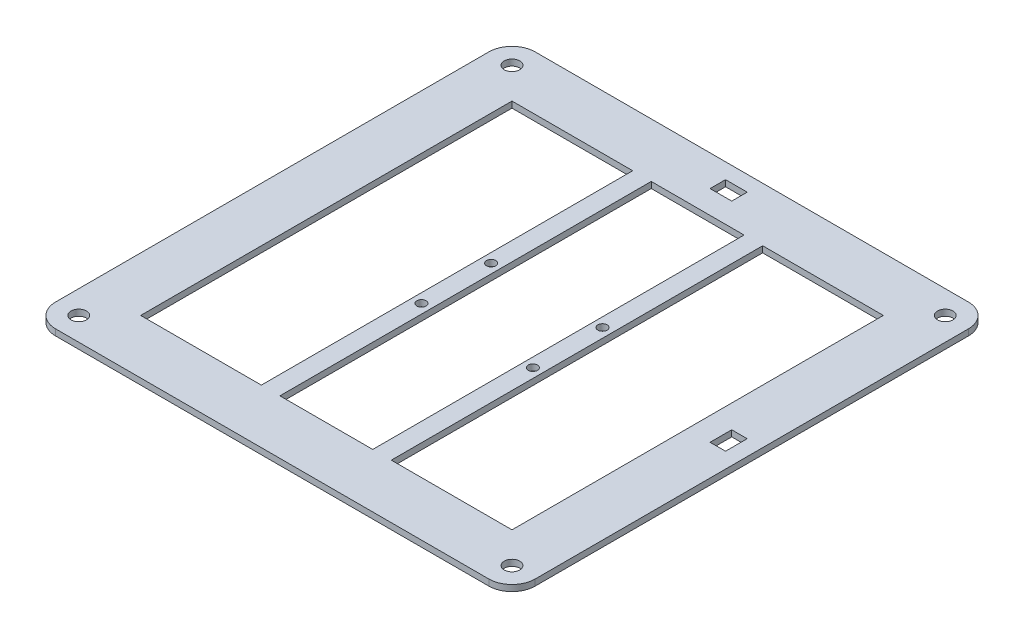
from build123d import *

# Parameters (mm, degrees)
CROQUIS1_W              = 160
CROQUIS1_H              = 160
CROQUIS1_R              = 1.5
CROQUIS1_R_2            = 2.5
CROQUIS1_W_2            = 39
CROQUIS1_H_2            = 120
CROQUIS1_W_3            = 30
CROQUIS1_W_4            = 5
CROQUIS1_H_3            = 7
CROQUIS1_W_5            = 7
CROQUIS1_H_4            = 5
SALIENTE_EXTRUIR1_DEPTH = 2
CORTAR_EXTRUIR1_DEPTH   = 10


with BuildPart() as part:
    # Croquis1 → Saliente-Extruir1 (new body)
    with BuildSketch(Plane(origin=(0, 0, 0), x_dir=(1, 0, 0), z_dir=(0, 1, 0))):
        with Locations((70, 70)):
            Rectangle(CROQUIS1_W, CROQUIS1_H)
        with Locations(Location((52, 81.25, 0), (0, 0, 270))):
            Circle(CROQUIS1_R, mode=Mode.SUBTRACT)
        with Locations(Location((52, 58.75, 0), (0, 0, 270))):
            Circle(CROQUIS1_R, mode=Mode.SUBTRACT)
        with Locations(Location((0, 140, 0), (0, 0, 270))):
            Circle(CROQUIS1_R_2, mode=Mode.SUBTRACT)
        with Locations(Location((0, 0, 0), (0, 0, 270))):
            Circle(CROQUIS1_R_2, mode=Mode.SUBTRACT)
        with Locations(Location((88, 81.25, 0), (0, 0, 90))):
            Circle(CROQUIS1_R, mode=Mode.SUBTRACT)
        with Locations(Location((88, 58.75, 0), (0, 0, 90))):
            Circle(CROQUIS1_R, mode=Mode.SUBTRACT)
        with Locations(Location((140, 0, 0), (0, 0, 90))):
            Circle(CROQUIS1_R_2, mode=Mode.SUBTRACT)
        with Locations(Location((140, 140, 0), (0, 0, 90))):
            Circle(CROQUIS1_R_2, mode=Mode.SUBTRACT)
        with Locations((29.5, 70)):
            Rectangle(CROQUIS1_W_2, CROQUIS1_H_2, mode=Mode.SUBTRACT)
        with Locations((110.5, 70)):
            Rectangle(CROQUIS1_W_2, CROQUIS1_H_2, mode=Mode.SUBTRACT)
        with Locations((70, 70)):
            Rectangle(CROQUIS1_W_3, CROQUIS1_H_2, mode=Mode.SUBTRACT)
        with Locations((140, 70)):
            Rectangle(CROQUIS1_W_4, CROQUIS1_H_3, mode=Mode.SUBTRACT)
        with Locations((70, 140)):
            Rectangle(CROQUIS1_W_5, CROQUIS1_H_4, mode=Mode.SUBTRACT)
    extrude(amount=SALIENTE_EXTRUIR1_DEPTH)

    # Croquis2 → Cortar-Extruir1 (cut)
    with BuildSketch(Plane(origin=(0, 2, 0), x_dir=(1, 0, 0), z_dir=(0, 1, 0))):
        Polygon((-10, 150), (-10, -10), (150, -10), (150, 150), (-7.5, 150), align=None)
        with BuildLine():
            ThreePointArc((-7.5, 140), (-5.303300859, 145.303300859), (0, 147.5))
            Line((0, 147.5), (140, 147.5))
            ThreePointArc((140, 147.5), (145.303300859, 145.303300859), (147.5, 140))
            Line((147.5, 140), (147.5, 0))
            ThreePointArc((147.5, 0), (145.303300859, -5.303300859), (140, -7.5))
            Line((140, -7.5), (0, -7.5))
            ThreePointArc((0, -7.5), (-5.303300859, -5.303300859), (-7.5, 0))
            Line((-7.5, 0), (-7.5, 140))
        make_face(mode=Mode.SUBTRACT)
    extrude(amount=-CORTAR_EXTRUIR1_DEPTH, mode=Mode.SUBTRACT)


solid = part.part
